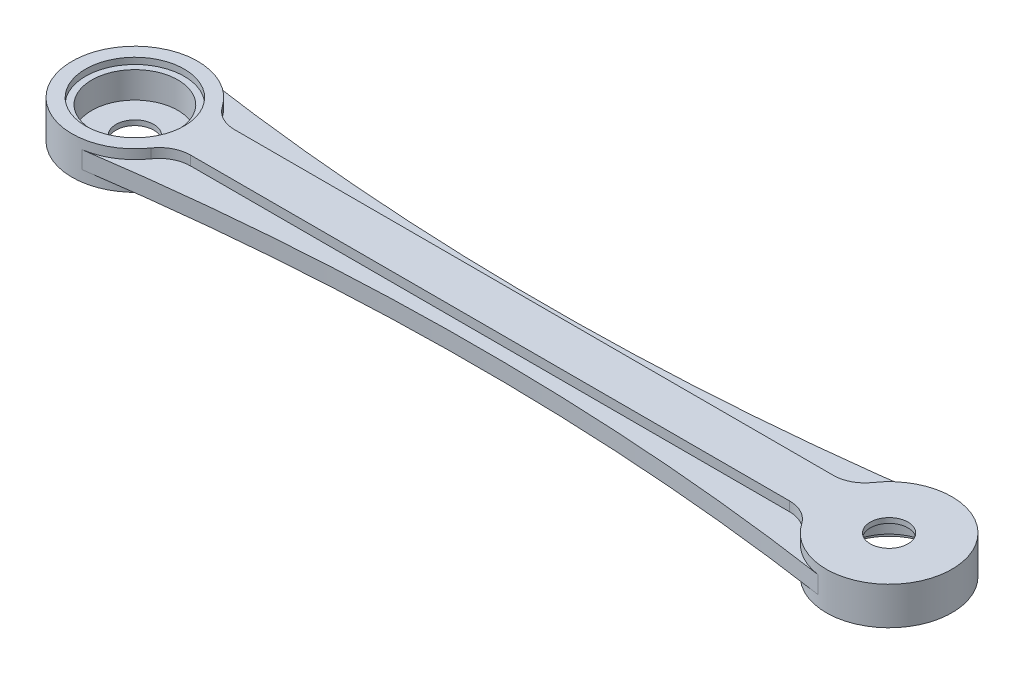
from build123d import *
from build123d.topology import SkipClean

# Parameters (mm, degrees)
SKETCH1_R           = 10
SKETCH1_R_2         = 7.85
SKETCH1_R_3         = 3
BOSS_EXTRUDE3_DEPTH = 6
SKETCH2_R           = 7.85
CUT_EXTRUDE1_DEPTH  = 1
SKETCH3_R           = 6.85
CUT_EXTRUDE2_DEPTH  = 4.2
SKETCH5_R           = 7.85
SKETCH5_R_2         = 3
CUT_EXTRUDE3_DEPTH  = 1
SKETCH6_R           = 6.85
CUT_EXTRUDE4_DEPTH  = 4.2
CUT_EXTRUDE5_DEPTH  = 1.5
CUT_EXTRUDE6_START  = -1.5
CUT_EXTRUDE6_DEPTH  = 1.5
CUT_EXTRUDE9_DEPTH  = 1.75


with BuildPart() as part:
    # Sketch1 → Boss-Extrude3 (new body)
    # profile 1 of 5: a face of its own
    with BuildSketch(Plane(origin=(0, 0, 0), x_dir=(1, 0, 0), z_dir=(0, 1, 0))):
        with Locations((-120, 0)):
            Circle(SKETCH1_R)
        with Locations((-120, 0)):
            Circle(SKETCH1_R_2, mode=Mode.SUBTRACT)
    # profile 2 of 5: a face of its own
    with BuildSketch(Plane(origin=(0, 0, 0), x_dir=(1, 0, 0), z_dir=(0, 1, 0))):
        with Locations((-120, 0)):
            Circle(SKETCH1_R_2)
        with Locations(Location((-120, 0, 0), (0, 0, 270))):
            Circle(SKETCH1_R_3, mode=Mode.SUBTRACT)
    # profile 3 of 5: a face of its own
    with BuildSketch(Plane(origin=(0, 0, 0), x_dir=(1, 0, 0), z_dir=(0, 1, 0))):
        with BuildLine():
            ThreePointArc((-1.463415785, -9.892341191), (-10, 3.94e-07), (-1.463415006, 9.892341306))
            ThreePointArc((-1.463415006, 9.892341306), (-60.000000188, 5.585995813), (-118.536585366, 9.892341361))
            ThreePointArc((-118.536585366, 9.892341361), (-112.429196002, 6.533217188), (-110, 0))
            ThreePointArc((-110, 0), (-112.429196002, -6.533217188), (-118.536585366, -9.892341361))
            ThreePointArc((-118.536585366, -9.892341361), (-60.000000582, -5.585995813), (-1.463415785, -9.892341191))
        make_face()
    # profile 4 of 5: a face of its own
    with BuildSketch(Plane(origin=(0, 0, 0), x_dir=(1, 0, 0), z_dir=(0, 1, 0))):
        Circle(SKETCH1_R)
        Circle(SKETCH1_R_2, mode=Mode.SUBTRACT)
    # profile 5 of 5: a face of its own
    with BuildSketch(Plane(origin=(0, 0, 0), x_dir=(1, 0, 0), z_dir=(0, 1, 0))):
        Circle(SKETCH1_R_2)
        with Locations(Location((0, 0, 0), (0, 0, 270))):
            Circle(SKETCH1_R_3, mode=Mode.SUBTRACT)
    extrude(amount=BOSS_EXTRUDE3_DEPTH)

    # Sketch2 → Cut-Extrude1 (cut)
    with BuildSketch(Plane(origin=(0, 6, 0), x_dir=(1, 0, 0), z_dir=(0, 1, 0))):
        with Locations(Location((-120, 0, 0), (0, 0, 270))):
            Circle(SKETCH2_R)
    extrude(amount=-CUT_EXTRUDE1_DEPTH, mode=Mode.SUBTRACT)

    # Sketch3 → Cut-Extrude2 (cut)
    with BuildSketch(Plane(origin=(0, 5, 0), x_dir=(1, 0, 0), z_dir=(0, 1, 0))):
        with Locations(Location((-120, 0, 0), (0, 0, 270))):
            Circle(SKETCH3_R)
    extrude(amount=-CUT_EXTRUDE2_DEPTH, mode=Mode.SUBTRACT)

    # Sketch5 → Cut-Extrude3 (cut)
    with BuildSketch(Plane.XZ):
        with Locations(Location((0, 0, 0), (0, 0, 270))):
            Circle(SKETCH5_R)
        with Locations(Location((0, 0, 0), (0, 0, 270))):
            Circle(SKETCH5_R_2, mode=Mode.SUBTRACT)
    extrude(amount=-CUT_EXTRUDE3_DEPTH, mode=Mode.SUBTRACT)

    # Sketch6 → Cut-Extrude4 (cut)
    with BuildSketch(Plane.XZ.offset(-1)):
        with Locations(Location((0, 0, 0), (0, 0, 270))):
            Circle(SKETCH6_R)
    extrude(amount=-CUT_EXTRUDE4_DEPTH, mode=Mode.SUBTRACT)

    # Sketch7 → Cut-Extrude5 (cut)
    with BuildSketch(Plane.XZ):
        with BuildLine():
            ThreePointArc((-8.239471396, 5.666666667), (-5.29155752, 8.485247139), (-1.463414634, 9.892341361))
            ThreePointArc((-1.463414634, 9.892341361), (-60, 5.585995813), (-118.536585366, 9.892341361))
            ThreePointArc((-118.536585366, 9.892341361), (-114.70844248, 8.485247139), (-111.760528604, 5.666666667))
            ThreePointArc((-111.760528604, 5.666666667), (-109.968166246, 4.074693984), (-107.640792906, 3.5))
            Line((-107.640792906, 3.5), (-12.359207094, 3.5))
            ThreePointArc((-12.359207094, 3.5), (-10.031833754, 4.074693984), (-8.239471396, 5.666666667))
        make_face()
        with BuildLine():
            ThreePointArc((-118.536585366, -9.892341361), (-60, -5.585995813), (-1.463414634, -9.892341361))
            ThreePointArc((-1.463414634, -9.892341361), (-5.29155752, -8.485247139), (-8.239471396, -5.666666667))
            ThreePointArc((-8.239471396, -5.666666667), (-10.031833754, -4.074693984), (-12.359207094, -3.5))
            Line((-12.359207094, -3.5), (-107.640792906, -3.5))
            ThreePointArc((-107.640792906, -3.5), (-109.968166246, -4.074693984), (-111.760528604, -5.666666667))
            ThreePointArc((-111.760528604, -5.666666667), (-114.70844248, -8.485247139), (-118.536585366, -9.892341361))
        make_face()
    extrude(amount=-CUT_EXTRUDE5_DEPTH, mode=Mode.SUBTRACT)

    # Sketch8 → Cut-Extrude6 (cut)
    with SkipClean():  # the faces are left unmerged after this step: merging them gives an invalid solid
        with BuildSketch(Plane(origin=(0, 6, 0), x_dir=(1, 0, 0), z_dir=(0, 1, 0)).offset(CUT_EXTRUDE6_START)):
            with BuildLine():
                ThreePointArc((-1.463414634, 9.892341361), (-60, 5.585995813), (-118.536585366, 9.892341361))
                ThreePointArc((-118.536585366, 9.892341361), (-114.70844248, 8.485247139), (-111.760528604, 5.666666667))
                ThreePointArc((-111.760528604, 5.666666667), (-109.968166246, 4.074693984), (-107.640792906, 3.5))
                Line((-107.640792906, 3.5), (-12.359207094, 3.5))
                ThreePointArc((-12.359207094, 3.5), (-10.031833754, 4.074693984), (-8.239471396, 5.666666667))
                ThreePointArc((-8.239471396, 5.666666667), (-5.29155752, 8.485247139), (-1.463414634, 9.892341361))
            make_face()
            with BuildLine():
                Line((-12.359207094, -3.5), (-107.640792906, -3.5))
                ThreePointArc((-107.640792906, -3.5), (-109.968166246, -4.074693984), (-111.760528604, -5.666666667))
                ThreePointArc((-111.760528604, -5.666666667), (-114.70844248, -8.485247139), (-118.536585366, -9.892341361))
                ThreePointArc((-118.536585366, -9.892341361), (-60, -5.585995813), (-1.463414634, -9.892341361))
                ThreePointArc((-1.463414634, -9.892341361), (-5.29155752, -8.485247139), (-8.239471396, -5.666666667))
                ThreePointArc((-8.239471396, -5.666666667), (-10.031833754, -4.074693984), (-12.359207094, -3.5))
            make_face()
        extrude(amount=CUT_EXTRUDE6_DEPTH, mode=Mode.SUBTRACT)

    # Sketch10 → Cut-Extrude9 (cut)
    with BuildSketch(Plane.XZ):
        with BuildLine():
            ThreePointArc((-1.463414634, 9.892341361), (-60, 5.585995813), (-118.536585366, 9.892341361))
            ThreePointArc((-118.536585366, 9.892341361), (-114.70844248, 8.485247139), (-111.760528604, 5.666666667))
            ThreePointArc((-111.760528604, 5.666666667), (-109.968166246, 4.074693984), (-107.640792906, 3.5))
            Line((-107.640792906, 3.5), (-12.359207094, 3.5))
            ThreePointArc((-12.359207094, 3.5), (-10.031833754, 4.074693984), (-8.239471396, 5.666666667))
            ThreePointArc((-8.239471396, 5.666666667), (-5.29155752, 8.485247139), (-1.463414634, 9.892341361))
        make_face()
        with BuildLine():
            Line((-12.359207094, -3.5), (-107.640792906, -3.5))
            ThreePointArc((-107.640792906, -3.5), (-109.968166246, -4.074693984), (-111.760528604, -5.666666667))
            ThreePointArc((-111.760528604, -5.666666667), (-114.70844248, -8.485247139), (-118.536585366, -9.892341361))
            ThreePointArc((-118.536585366, -9.892341361), (-60, -5.585995813), (-1.463414634, -9.892341361))
            ThreePointArc((-1.463414634, -9.892341361), (-5.29155752, -8.485247139), (-8.239471396, -5.666666667))
            ThreePointArc((-8.239471396, -5.666666667), (-10.031833754, -4.074693984), (-12.359207094, -3.5))
        make_face()
    extrude(amount=-CUT_EXTRUDE9_DEPTH, mode=Mode.SUBTRACT)


solid = part.part
